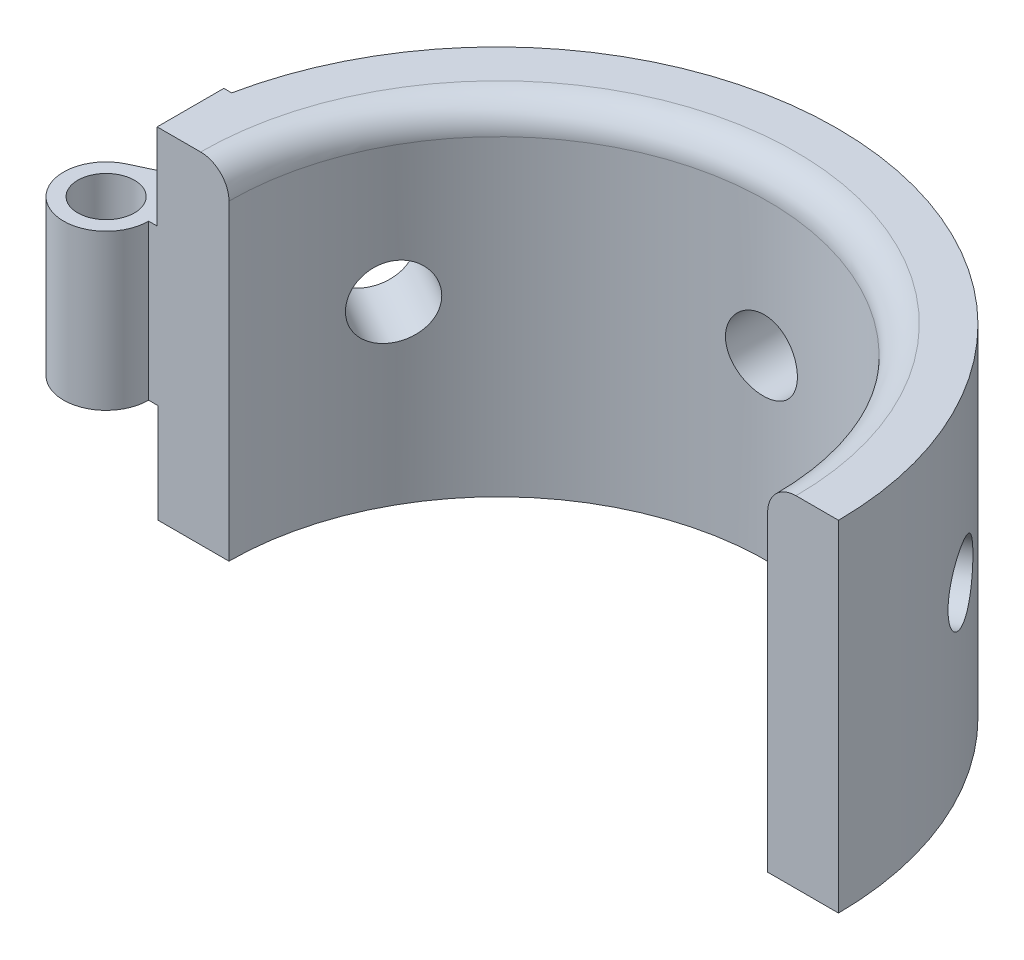
from build123d import *

# Parameters (mm, degrees)
BOSS_EXTRUDE1_DEPTH     = 30.48
SKETCH3_R               = 24.13
CUT_EXTRUDE4_DEPTH      = 90.914560616
SKETCH4_R               = 3.175
CUT_EXTRUDE5_DEPTH      = 63.754
CIRPATTERN3_COUNT       = 6
BOSS_EXTRUDE3_START     = -21.59
SKETCH8_R               = 2.54
BOSS_EXTRUDE3_DEPTH     = 21.59
CUT_EXTRUDE7_DEPTH      = 98.433832269
CUT_EXTRUDE7_DEPTH_BACK = 98.433832269
SKETCH9_W               = 7.62
SKETCH9_H               = 7.694027115
SKETCH10_W              = 0.762
SKETCH10_H              = 7.694027115
CUT_EXTRUDE8_DEPTH      = 21.59
FILLET1_R               = 2.54


with BuildPart() as part:
    # Sketch1 → Boss-Extrude1 (new body)
    with BuildSketch(Plane(origin=(0, 0, 0), x_dir=(1, 0, 0), z_dir=(0, 1, 0))):
        with BuildLine():
            Line((-78.958715675, 0), (-17.998715675, 0))
            ThreePointArc((-17.998715675, 0), (-48.478715675, 30.349942827), (-78.958715675, 0))
        make_face()
    extrude(amount=BOSS_EXTRUDE1_DEPTH)

    # Sketch3 → Cut-Extrude4 (cut, through all)
    with BuildSketch(Plane(origin=(0, 0, 0), x_dir=(1, 0, 0), z_dir=(0, 1, 0))):
        with Locations((-48.478715675, 0)):
            Circle(SKETCH3_R)
    extrude(amount=CUT_EXTRUDE4_DEPTH, mode=Mode.SUBTRACT)

    # Sketch4 → Cut-Extrude5 (cut)
    with BuildSketch(Plane.XY):
        with Locations((-48.824364134, 15.798935299)):
            Circle(SKETCH4_R)
    cut_extrude5 = extrude(amount=-CUT_EXTRUDE5_DEPTH, mode=Mode.SUBTRACT)

    # CirPattern3: Cut-Extrude5 ×6 about axis
    cirpattern3_axis = Axis((-48.478715675, 30.48, 0.130335837), (0, -1, 0))
    for i in range(1, CIRPATTERN3_COUNT):
        add(cut_extrude5.rotate(cirpattern3_axis, i * 360 / CIRPATTERN3_COUNT), mode=Mode.SUBTRACT)

    # Sketch8 → Boss-Extrude3 (add)
    with BuildSketch(Plane(origin=(0, 30.48, 0), x_dir=(1, 0, 0), z_dir=(0, 1, 0)).offset(BOSS_EXTRUDE3_START)):
        with BuildLine():
            ThreePointArc((-85.222855562, 3.454304155), (-85.663790647, -3.212512214), (-79.805409512, 0))
            Line((-79.805409512, 0), (-78.958715675, 0))
            ThreePointArc((-78.958715675, 0), (-78.797525927, 3.002894504), (-78.341212544, 5.975290109))
            Line((-78.341212544, 5.975290109), (-78.958715675, 5.975290109))
            Line((-78.958715675, 5.975290109), (-79.805409512, 5.975290109))
            Line((-79.805409512, 5.975290109), (-85.222855562, 3.454304155))
        make_face()
        with Locations(Location((-83.615409512, 0, 0), (0, 0, 270))):
            Circle(SKETCH8_R, mode=Mode.SUBTRACT)
    extrude(amount=BOSS_EXTRUDE3_DEPTH)

    # Sketch9 → Cut-Extrude7 (cut, two sides: drawn at the far end of the back side and taken through both)
    with BuildSketch(Plane.XY.offset(-CUT_EXTRUDE7_DEPTH_BACK)):
        with Locations((-83.615409512, 26.632986443)):
            Rectangle(SKETCH9_W, SKETCH9_H)
    extrude(amount=CUT_EXTRUDE7_DEPTH + CUT_EXTRUDE7_DEPTH_BACK, mode=Mode.SUBTRACT)

    # Sketch10 → Cut-Extrude8 (cut)
    with BuildSketch(Plane.XY):
        with Locations((-79.424409512, 26.632986443)):
            Rectangle(SKETCH10_W, SKETCH10_H)
    extrude(amount=-CUT_EXTRUDE8_DEPTH, mode=Mode.SUBTRACT)

    # Fillet1
    fillet1_edges = [part.edges().sort_by_distance(p)[0] for p in [
        (-48.478715675, 30.48, -24.13),
    ]]
    fillet(fillet1_edges, radius=FILLET1_R)


solid = part.part
